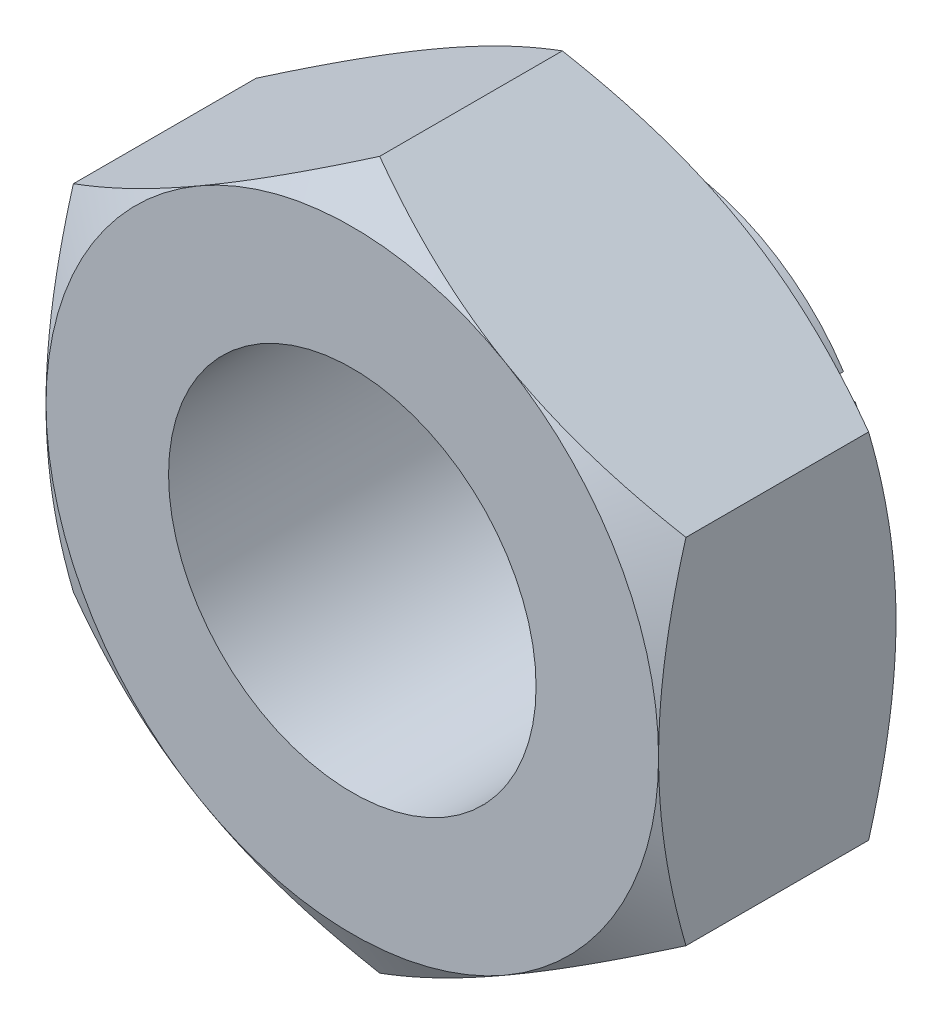
from build123d import *

# Parameters (mm, degrees)
EXTRUDE1_DEPTH          = 5
SKETCH2_OUTSIDE_W       = 50.302
SKETCH2_OUTSIDE_H       = 51.85
SKETCH2_OUTSIDE_R       = 5
CUT_EXTRUDE1_DEPTH      = 10.128709292
CUT_EXTRUDE1_DRAFT      = -60
SKETCH4_R               = 3
CUT_EXTRUDE3_DEPTH      = 10.128709292
SKETCH12_OUTSIDE_W      = 15.214
SKETCH12_OUTSIDE_H      = 16.762
SKETCH12_OUTSIDE_R      = 3.6
CUT_EXTRUDE10_DEPTH     = 1.125
SKETCH15_W              = 0.381
SKETCH15_H              = 5.773502692
CUT_EXTRUDE_THIN2_DEPTH = 0.617
CIRPATTERN1_COUNT       = 6
SKETCH3_OUTSIDE_W       = 48.346
SKETCH3_OUTSIDE_H       = 49.894
SKETCH3_OUTSIDE_R       = 5
CUT_EXTRUDE2_DEPTH      = 9.564400641
CUT_EXTRUDE2_DRAFT      = -60


with BuildPart() as part:
    # Sketch1 → Extrude1 (new body)
    with BuildSketch(Plane.XY):
        Polygon((0, 5.773502692), (-5, 2.886751346), (-5, -2.886751346), (0, -5.773502692), (5, -2.886751346), (5, 2.886751346), align=None)
    extrude(amount=-EXTRUDE1_DEPTH)


with BuildPart() as cut_extrude1_tool:
    # Sketch2 outside → Cut-Extrude1 (with draft: the straight prism first)
    with BuildSketch(Plane.XY):
        Rectangle(SKETCH2_OUTSIDE_W, SKETCH2_OUTSIDE_H)
        Circle(SKETCH2_OUTSIDE_R, mode=Mode.SUBTRACT)
    extrude(amount=-CUT_EXTRUDE1_DEPTH)
    # Cut-Extrude1: the draft: its side faces are tilted about the plane it starts from
    cut_extrude1_sides = [cut_extrude1_tool.faces().sort_by_distance(p)[0] for p in [
        (0, -25.925, -5.064354646),
        (25.151, 0, -5.064354646),
        (0, 25.925, -5.064354646),
        (-25.151, 0, -5.064354646),
        (-5, 0, -5.064354646),
    ]]
    draft(cut_extrude1_sides, Plane.XY, CUT_EXTRUDE1_DRAFT)


with BuildPart() as part_1:
    add(part.part)

    # Cut-Extrude1: cut by cut_extrude1_tool
    add(cut_extrude1_tool.part, mode=Mode.SUBTRACT)

    # Sketch4 → Cut-Extrude3 (cut, through all)
    with BuildSketch(Plane.XY):
        Circle(SKETCH4_R)
    extrude(amount=-CUT_EXTRUDE3_DEPTH, mode=Mode.SUBTRACT)

    # Sketch12 outside → Cut-Extrude10 (cut)
    with BuildSketch(Plane(origin=(0, 0, -5), x_dir=(-1, 0, 0), z_dir=(0, 0, -1))):
        Rectangle(SKETCH12_OUTSIDE_W, SKETCH12_OUTSIDE_H)
        Circle(SKETCH12_OUTSIDE_R, mode=Mode.SUBTRACT)
    extrude(amount=-CUT_EXTRUDE10_DEPTH, mode=Mode.SUBTRACT)

    # Sketch15 → Cut-Extrude-Thin2 (cut)
    with BuildSketch(Plane(origin=(0, 0, -5), x_dir=(-1, 0, 0), z_dir=(0, 0, -1))):
        with Locations((0, -2.886751346)):
            Rectangle(SKETCH15_W, SKETCH15_H)
    cut_extrude_thin2 = extrude(amount=-CUT_EXTRUDE_THIN2_DEPTH, mode=Mode.SUBTRACT)

    # CirPattern1: Cut-Extrude-Thin2 ×6 about axis
    cirpattern1_axis = Axis((0, 0, 0), (0, 0, 1))
    for i in range(1, CIRPATTERN1_COUNT):
        add(cut_extrude_thin2.rotate(cirpattern1_axis, i * 360 / CIRPATTERN1_COUNT), mode=Mode.SUBTRACT)


with BuildPart() as cut_extrude2_tool:
    # Sketch3 outside → Cut-Extrude2 (with draft: the straight prism first)
    with BuildSketch(Plane(origin=(0, 0, -3.875), x_dir=(-1, 0, 0), z_dir=(0, 0, -1))):
        Rectangle(SKETCH3_OUTSIDE_W, SKETCH3_OUTSIDE_H)
        Circle(SKETCH3_OUTSIDE_R, mode=Mode.SUBTRACT)
    extrude(amount=-CUT_EXTRUDE2_DEPTH)
    # Cut-Extrude2: the draft: its side faces are tilted about the plane it starts from
    cut_extrude2_sides = [cut_extrude2_tool.faces().sort_by_distance(p)[0] for p in [
        (0, -24.947, 0.90720032),
        (-24.173, 0, 0.90720032),
        (0, 24.947, 0.90720032),
        (24.173, 0, 0.90720032),
        (5, 0, 0.90720032),
    ]]
    draft(cut_extrude2_sides, Plane(origin=(0, 0, -3.875), x_dir=(-1, 0, 0), z_dir=(0, 0, -1)), CUT_EXTRUDE2_DRAFT)


with BuildPart() as part_2:
    add(part_1.part)

    # Cut-Extrude2: cut by cut_extrude2_tool
    add(cut_extrude2_tool.part, mode=Mode.SUBTRACT)


solid = part_2.part
